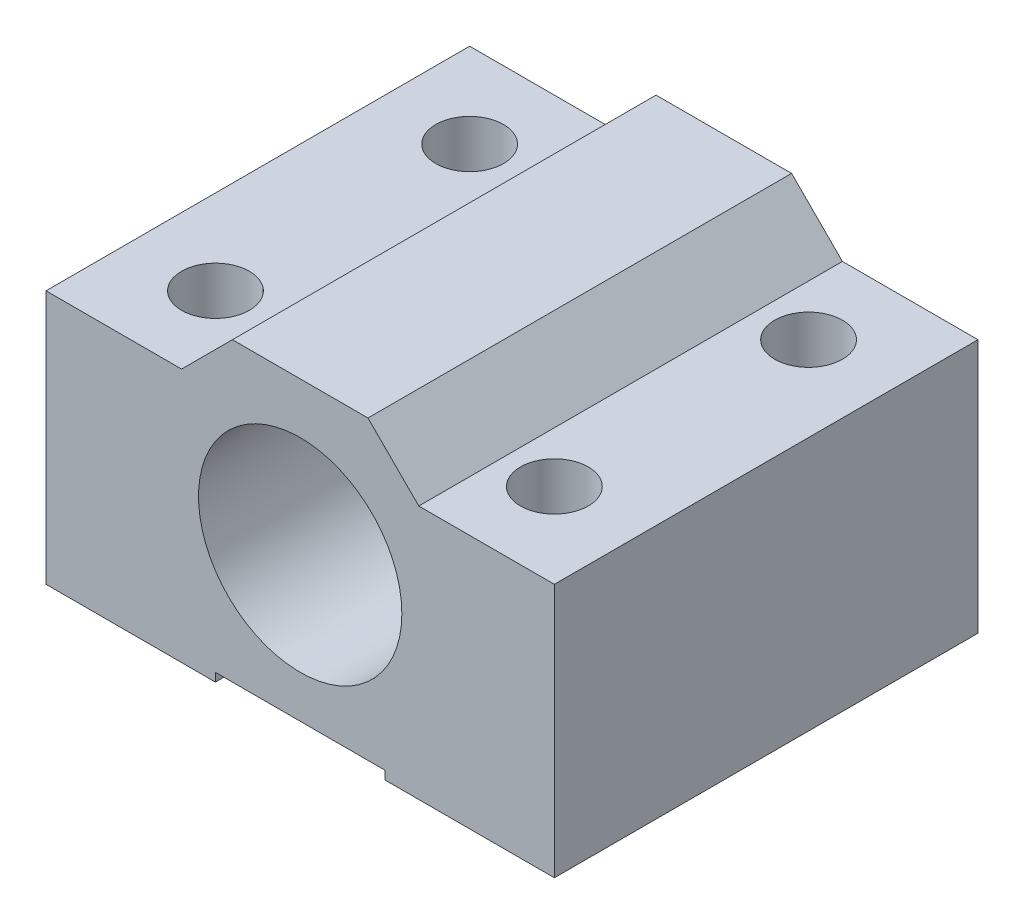
from build123d import *

# Parameters (mm, degrees)
BOSS_EXTRU_1_DEPTH      = 25
ESQUISSE2_R             = 6
ENL_V_MAT_EXTRU_1_DEPTH = 25
ESQUISSE3_R             = 2
ENL_V_MAT_EXTRU_2_DEPTH = 33.787192622
ESQUISSE4_W             = 10
ESQUISSE4_H             = 25
ENL_V_MAT_EXTRU_3_DEPTH = 0.5


with BuildPart() as part:
    # Esquisse1 → Boss.-Extru.1 (new body)
    with BuildSketch(Plane.XY):
        Polygon((15, 0), (-15, 0), (-15, 15), (-7, 15), (-4, 18), (4, 18), (7, 15), (15, 15), align=None)
    extrude(amount=BOSS_EXTRU_1_DEPTH)

    # Esquisse2 → Enlèv. mat.-Extru.1 (cut)
    with BuildSketch(Plane.XY.offset(25)):
        with Locations((0, 9)):
            Circle(ESQUISSE2_R)
    extrude(amount=-ENL_V_MAT_EXTRU_1_DEPTH, mode=Mode.SUBTRACT)

    # Esquisse3 → Enlèv. mat.-Extru.2 (cut, through all)
    with BuildSketch(Plane(origin=(0, 15, 0), x_dir=(1, 0, 0), z_dir=(0, 1, 0))):
        with Locations(Location((-10, -5, 0), (0, 0, 180))):
            Circle(ESQUISSE3_R)
        with Locations((10, -5)):
            Circle(ESQUISSE3_R)
        with Locations(Location((10, -20, 0), (0, 0, 180))):
            Circle(ESQUISSE3_R)
        with Locations((-10, -20)):
            Circle(ESQUISSE3_R)
    extrude(amount=-ENL_V_MAT_EXTRU_2_DEPTH, mode=Mode.SUBTRACT)

    # Esquisse4 → Enlèv. mat.-Extru.3 (cut)
    with BuildSketch(Plane.XZ):
        with Locations((0, 12.5)):
            Rectangle(ESQUISSE4_W, ESQUISSE4_H)
    extrude(amount=-ENL_V_MAT_EXTRU_3_DEPTH, mode=Mode.SUBTRACT)


solid = part.part
